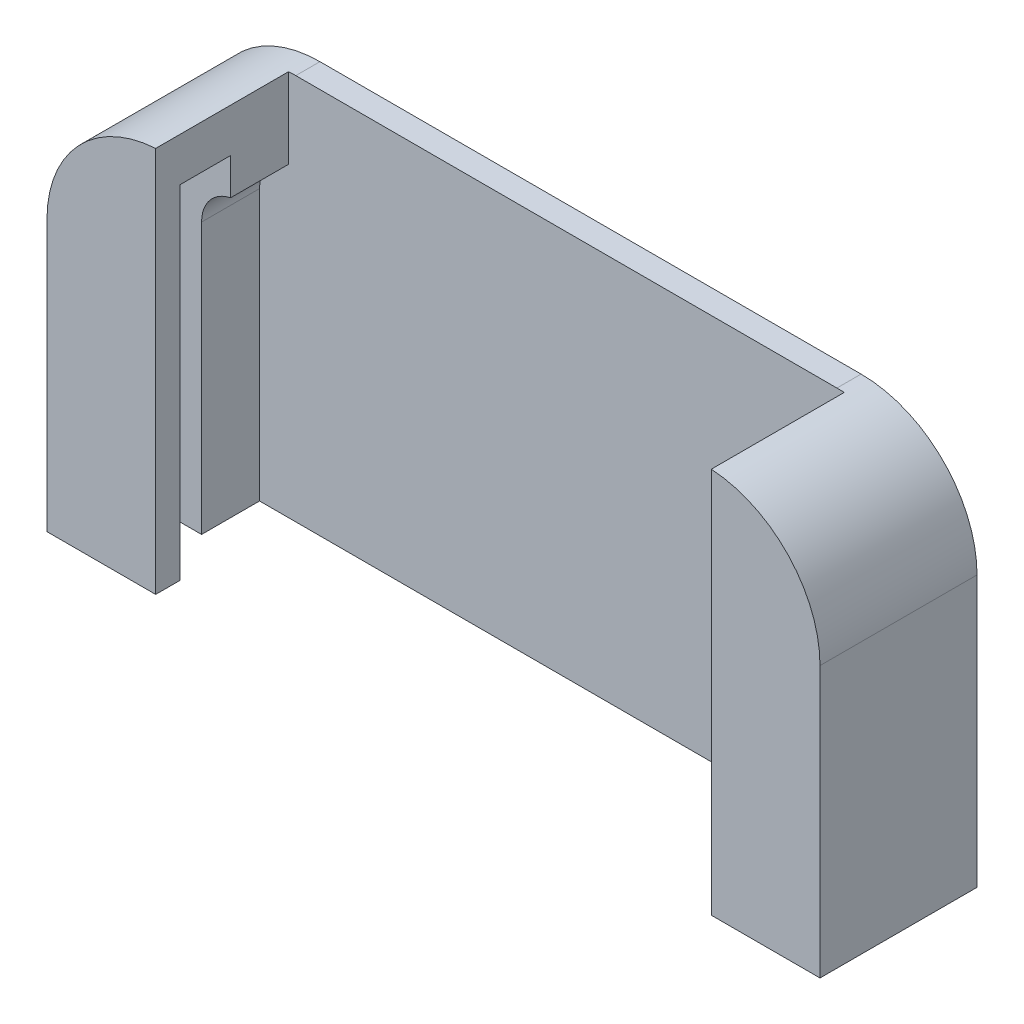
from build123d import *

# Parameters (mm, degrees)
BOSS_EXTRUDE2_DEPTH     = 5.5
CUT_EXTRUDE1_DEPTH      = 4.5
BOSS_EXTRUDE3_START     = 2.4
BOSS_EXTRUDE3_DEPTH     = 2.4
SALIENTE_EXTRUIR1_DEPTH = 1
CORTAR_EXTRUIR3_REACH   = 38.363
CROQUIS3_W              = 23
CROQUIS3_H              = 4.5


with BuildPart() as part:
    # Sketch3 → Boss-Extrude2 (new body)
    with BuildSketch(Plane.XY):
        with BuildLine():
            Line((0, 0), (32, 0))
            Line((32, 0), (32, 11.2))
            ThreePointArc((32, 11.2), (30.59411255, 14.59411255), (27.2, 16))
            Line((27.2, 16), (4.8, 16))
            ThreePointArc((4.8, 16), (1.40588745, 14.59411255), (0, 11.2))
            Line((0, 11.2), (0, 0))
        make_face()
    extrude(amount=BOSS_EXTRUDE2_DEPTH)

    # Sketch4 → Cut-Extrude1 (cut)
    with BuildSketch(Plane.XY.offset(5.5)):
        with BuildLine():
            Line((1.8, 0), (30.2, 0))
            Line((30.2, 0), (30.2, 11.2))
            ThreePointArc((30.2, 11.2), (29.321320344, 13.321320344), (27.2, 14.2))
            Line((27.2, 14.2), (4.8, 14.2))
            ThreePointArc((4.8, 14.2), (2.678679656, 13.321320344), (1.8, 11.2))
            Line((1.8, 11.2), (1.8, 0))
        make_face()
    extrude(amount=-CUT_EXTRUDE1_DEPTH, mode=Mode.SUBTRACT)

    # Sketch5 → Boss-Extrude3 (add)
    with BuildSketch(Plane.XY.offset(1).offset(BOSS_EXTRUDE3_START)):
        with BuildLine():
            Line((1.8, 11.2), (1.8, 0))
            Line((1.8, 0), (3.3, 0))
            Line((3.3, 0), (3.3, 11.2))
            ThreePointArc((3.3, 11.2), (3.739339828, 12.260660172), (4.8, 12.7))
            Line((4.8, 12.7), (27.2, 12.7))
            ThreePointArc((27.2, 12.7), (28.260660172, 12.260660172), (28.7, 11.2))
            Line((28.7, 11.2), (28.7, 0))
            Line((28.7, 0), (30.2, 0))
            Line((30.2, 0), (30.2, 11.2))
            ThreePointArc((30.2, 11.2), (29.321320344, 13.321320344), (27.2, 14.2))
            Line((27.2, 14.2), (4.8, 14.2))
            ThreePointArc((4.8, 14.2), (2.678679656, 13.321320344), (1.8, 11.2))
        make_face()
    extrude(amount=-BOSS_EXTRUDE3_DEPTH)

    # Croquis1 → Saliente-Extruir1 (add)
    with BuildSketch(Plane.XY.offset(5.5)):
        with BuildLine():
            Line((4.5, 0), (4.5, 15.990615827))
            ThreePointArc((4.5, 15.990615827), (1.301428863, 14.486335345), (0, 11.2))
            Line((0, 11.2), (0, 0))
            Line((0, 0), (4.5, 0))
        make_face()
        with BuildLine():
            Line((27.5, 15.990615827), (27.5, 0))
            Line((27.5, 0), (32, 0))
            Line((32, 0), (32, 11.2))
            ThreePointArc((32, 11.2), (30.698571137, 14.486335345), (27.5, 15.990615827))
        make_face()
    extrude(amount=SALIENTE_EXTRUIR1_DEPTH)

    # Croquis3 → Cortar-Extruir3 (cut, up to next)
    with BuildSketch(Plane(origin=(0, 16, 0), x_dir=(1, 0, 0), z_dir=(0, 1, 0)), mode=Mode.PRIVATE) as cortar_extruir3_sk1:
        with Locations((16, -3.25)):
            Rectangle(CROQUIS3_W, CROQUIS3_H)
    cortar_extruir3_tool1 = extrude(cortar_extruir3_sk1.sketch, amount=-CORTAR_EXTRUIR3_REACH, mode=Mode.PRIVATE) & part.part
    add(cortar_extruir3_tool1.solids().sort_by_distance((16, 16, 3.25))[0], mode=Mode.SUBTRACT)


solid = part.part
